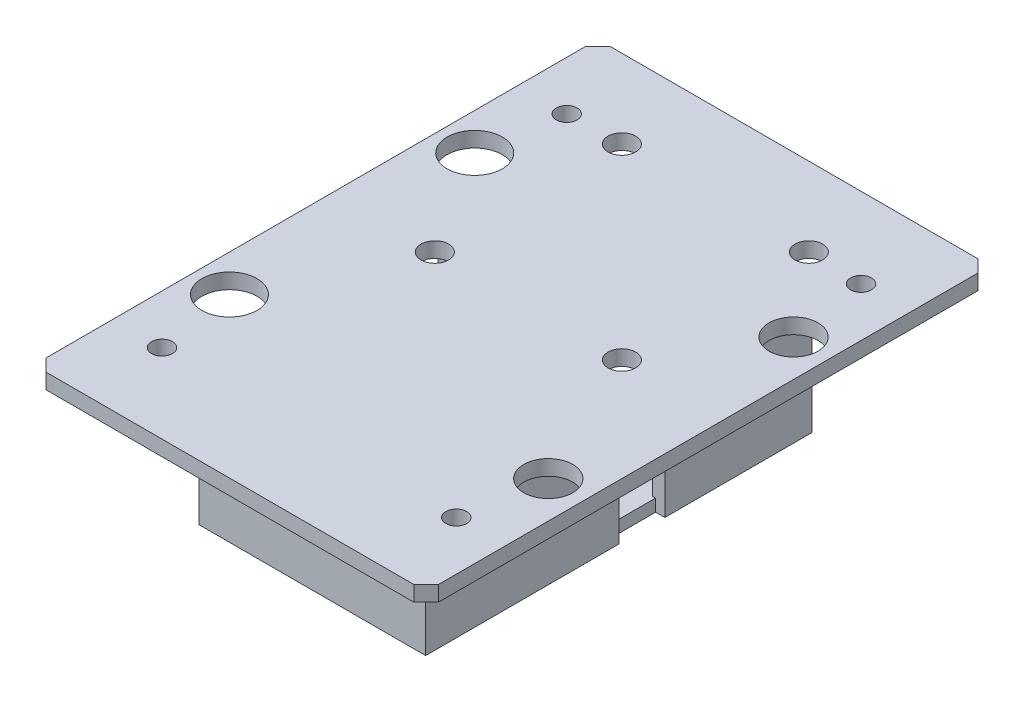
from build123d import *

# Parameters (mm, degrees)
SKETCH_1_R        = 2.25
SKETCH_1_R_2      = 1.7
SKETCH_1_R_3      = 4.5
SKETCH_1_R_4      = 4
EXTRUDE_1_DEPTH   = 2.5
EXTRUDE_START     = -20
SKETCH_2_W        = 5
SKETCH_2_H        = 61
EXTRUDE_2_DEPTH   = 2
EXTRUDE_2_2_DEPTH = 2
SKETCH_3_W        = 2
SKETCH_3_H        = 29.5
SKETCH_3_H_2      = 24
EXTRUDE_3_DEPTH   = 20
SKETCH_4_W        = 37
SKETCH_4_H        = 2.5
EXTRUDE_4_DEPTH   = 20


with BuildPart() as part:
    # 草图1 → 凸台-拉伸1 (new body)
    with BuildSketch(Plane(origin=(0, 0, 0), x_dir=(1, 0, 0), z_dir=(0, 1, 0))):
        Polygon((-30, -45.917034388), (30, -45.917034388), (32, -43.917034388), (32, 44.082965612), (30, 46.082965612), (-30, 46.082965612), (-32, 44.082965612), (-32, -43.917034388), align=None)
        with Locations(Location((-15.25, 2.75, 0), (0, 0, 270))):
            Circle(SKETCH_1_R, mode=Mode.SUBTRACT)
        with Locations(Location((-15.25, 33.25, 0), (0, 0, 270))):
            Circle(SKETCH_1_R, mode=Mode.SUBTRACT)
        with Locations(Location((15.25, 2.75, 0), (0, 0, 270))):
            Circle(SKETCH_1_R, mode=Mode.SUBTRACT)
        with Locations(Location((15.25, 33.25, 0), (0, 0, 270))):
            Circle(SKETCH_1_R, mode=Mode.SUBTRACT)
        with Locations(Location((-24, -33, 0), (0, 0, 270))):
            Circle(SKETCH_1_R_2, mode=Mode.SUBTRACT)
        with Locations(Location((-26, -20, 0), (0, 0, 270))):
            Circle(SKETCH_1_R_3, mode=Mode.SUBTRACT)
        with Locations(Location((-26, 20, 0), (0, 0, 270))):
            Circle(SKETCH_1_R_3, mode=Mode.SUBTRACT)
        with Locations(Location((26, -20, 0), (0, 0, 270))):
            Circle(SKETCH_1_R_4, mode=Mode.SUBTRACT)
        with Locations(Location((26, 20, 0), (0, 0, 270))):
            Circle(SKETCH_1_R_4, mode=Mode.SUBTRACT)
        with Locations(Location((24, -33, 0), (0, 0, 90))):
            Circle(SKETCH_1_R_2, mode=Mode.SUBTRACT)
        with Locations(Location((24, 33, 0), (0, 0, 270))):
            Circle(SKETCH_1_R_2, mode=Mode.SUBTRACT)
        with Locations(Location((-24, 33, 0), (0, 0, 90))):
            Circle(SKETCH_1_R_2, mode=Mode.SUBTRACT)
    extrude(amount=EXTRUDE_1_DEPTH)



with BuildPart() as body_2:
    # 草图2 → 凸台-拉伸2 (new body)
    with BuildSketch(Plane(origin=(0, 0, 0), x_dir=(1, 0, 0), z_dir=(0, 1, 0)).offset(EXTRUDE_START)):
        with Locations((14.5, 0)):
            Rectangle(SKETCH_2_W, SKETCH_2_H)
    extrude(amount=EXTRUDE_2_DEPTH)


with BuildPart() as body_3:
    # 草图2 → Extrude 2 2 (new body)
    with BuildSketch(Plane(origin=(0, 0, 0), x_dir=(1, 0, 0), z_dir=(0, 1, 0)).offset(EXTRUDE_START)):
        with Locations((-14.5, 0)):
            Rectangle(SKETCH_2_W, SKETCH_2_H)
    extrude(amount=EXTRUDE_2_2_DEPTH)


with BuildPart() as part_1:
    add(part.part)

    add(body_2.part)  # 凸台-拉伸3 merges body 2

    add(body_3.part)  # 凸台-拉伸3 merges body 3
    # 草图3 → 凸台-拉伸3 (add)
    with BuildSketch(Plane(origin=(0, 0, 0), x_dir=(1, 0, 0), z_dir=(0, 1, 0)).offset(EXTRUDE_START)):
        with Locations((17.5, -15.75)):
            Rectangle(SKETCH_3_W, SKETCH_3_H)
        with Locations((-17.5, -15.75)):
            Rectangle(SKETCH_3_W, SKETCH_3_H)
        with Locations((17.5, 18.5)):
            Rectangle(SKETCH_3_W, SKETCH_3_H_2)
        with Locations((-17.5, 18.5)):
            Rectangle(SKETCH_3_W, SKETCH_3_H_2)
    extrude(amount=EXTRUDE_3_DEPTH)

    # 草图4 → 凸台-拉伸4 (add)
    with BuildSketch(Plane(origin=(0, 0, 0), x_dir=(1, 0, 0), z_dir=(0, 1, 0)).offset(EXTRUDE_START)):
        with Locations((0, -31.25)):
            Rectangle(SKETCH_4_W, SKETCH_4_H)
    extrude(amount=EXTRUDE_4_DEPTH)


solid = part_1.part
